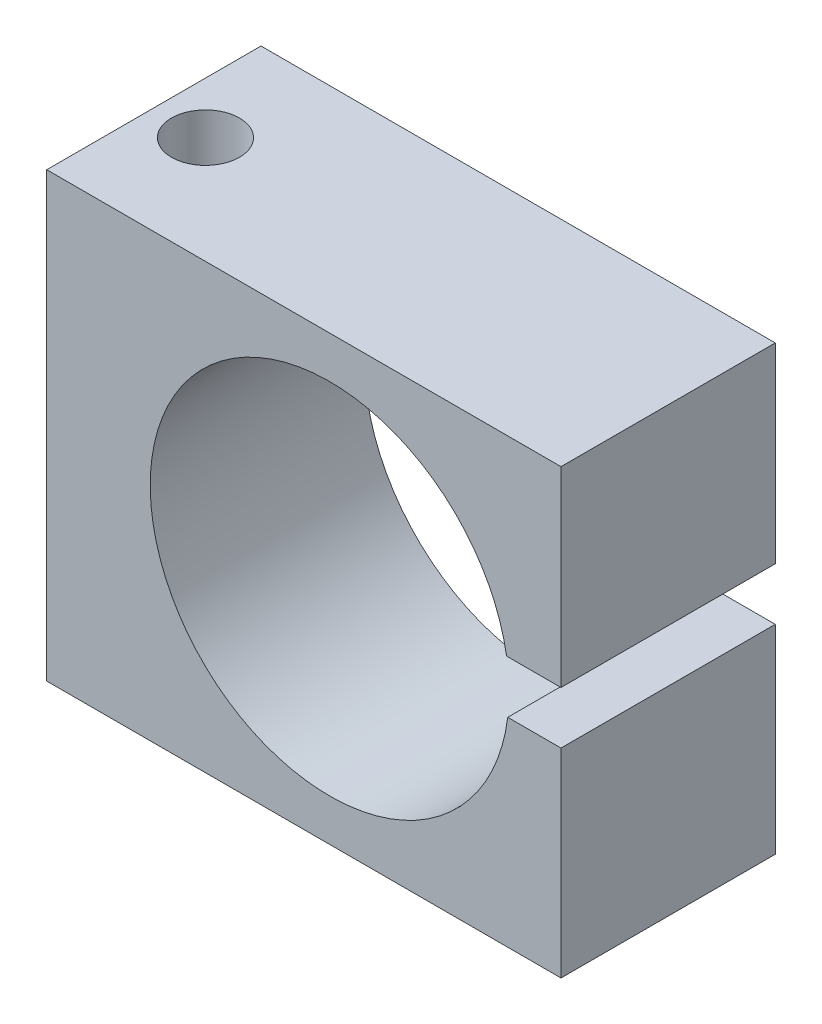
from build123d import *

# Parameters (mm, degrees)
CROQUIS1_W                    = 40
CROQUIS1_H                    = 31.334822808
SALIENTE_EXTRUIR1_DEPTH       = 20
CROQUIS2_W                    = 5.048174606
CROQUIS2_H                    = 4.893641636
CORTAR_EXTRUIR1_DEPTH         = 41.340288801
TALADRO1_D                    = 6.35
TALADRO_DE_MARGEN_PARA_M221_D = 25.4
CROQUIS7_W                    = 20
CROQUIS7_H                    = 12.852705172
CROQUIS7_H_2                  = 13.588476
SALIENTE_EXTRUIR2_DEPTH       = 8
CROQUIS8_W                    = 48
CROQUIS8_H                    = 20
SALIENTE_EXTRUIR3_DEPTH       = 5
CROQUIS9_R                    = 3.175
CORTAR_EXTRUIR2_DEPTH         = 43
CROQUIS10_W                   = 48
CROQUIS10_H                   = 20
SALIENTE_EXTRUIR4_DEPTH       = 5
CORTAR_EXTRUIR3_START         = -48
CROQUIS11_R                   = 3.175
CORTAR_EXTRUIR3_DEPTH         = 48
CROQUIS12_R                   = 16.75
CORTAR_EXTRUIR4_DEPTH         = 48


with BuildPart() as part:
    # Croquis1 → Saliente-Extruir1 (new body)
    with BuildSketch(Plane(origin=(0, 0, 0), x_dir=(-1, 0, 0), z_dir=(0, 0, -1))):
        with Locations((11.334822808, 0)):
            Rectangle(CROQUIS1_W, CROQUIS1_H)
    extrude(amount=-SALIENTE_EXTRUIR1_DEPTH)

    # Croquis2 → Cortar-Extruir1 (cut, through all)
    with BuildSketch(Plane.XY.offset(20)):
        with Locations((6.141089889, 0.367885414)):
            Rectangle(CROQUIS2_W, CROQUIS2_H)
    extrude(amount=-CORTAR_EXTRUIR1_DEPTH, mode=Mode.SUBTRACT)

    # Taladro1 (through all)
    with Locations(Plane(origin=(0, 15.667411404, 0), x_dir=(1, 0, 0), z_dir=(0, 1, 0))):
        with Locations((-26.51855843, -10)):
            Hole(TALADRO1_D / 2)

    # Taladro de margen para M221 (through all)
    with Locations(Plane(origin=(0, 0, 0), x_dir=(-1, 0, 0), z_dir=(0, 0, -1))):
        with Locations((8.767354232, 0)):
            Hole(TALADRO_DE_MARGEN_PARA_M221_D / 2)

    # Croquis7 → Saliente-Extruir2 (add)
    with BuildSketch(Plane(origin=(8.665177192, 0, 0), x_dir=(0, 0, -1), z_dir=(1, 0, 0))):
        with Locations((-10, 9.241058818)):
            Rectangle(CROQUIS7_W, CROQUIS7_H)
        with Locations((-10, -8.873173404)):
            Rectangle(CROQUIS7_W, CROQUIS7_H_2)
    extrude(amount=SALIENTE_EXTRUIR2_DEPTH)

    # Croquis8 → Saliente-Extruir3 (add)
    with BuildSketch(Plane(origin=(0, 15.667411404, 0), x_dir=(1, 0, 0), z_dir=(0, 1, 0))):
        with Locations((-7.334822808, -10)):
            Rectangle(CROQUIS8_W, CROQUIS8_H)
    extrude(amount=SALIENTE_EXTRUIR3_DEPTH)

    # Croquis9 → Cortar-Extruir2 (cut)
    with BuildSketch(Plane.XZ.offset(15.667411404)):
        with Locations(Location((-26.51855843, 10, 0), (0, 0, 90))):
            Circle(CROQUIS9_R)
    extrude(amount=-CORTAR_EXTRUIR2_DEPTH, mode=Mode.SUBTRACT)

    # Croquis10 → Saliente-Extruir4 (add)
    with BuildSketch(Plane.XZ.offset(15.667411404)):
        with Locations((-7.334822808, 10)):
            Rectangle(CROQUIS10_W, CROQUIS10_H)
    extrude(amount=SALIENTE_EXTRUIR4_DEPTH)

    # Croquis11 → Cortar-Extruir3 (cut)
    with BuildSketch(Plane(origin=(0, 20.667411404, 0), x_dir=(1, 0, 0), z_dir=(0, 1, 0)).offset(CORTAR_EXTRUIR3_START)):
        with Locations(Location((-26.51855843, -10, 0), (0, 0, 90))):
            Circle(CROQUIS11_R)
    extrude(amount=CORTAR_EXTRUIR3_DEPTH, mode=Mode.SUBTRACT)

    # Croquis12 → Cortar-Extruir4 (cut)
    with BuildSketch(Plane.XY.offset(20)):
        with Locations((-4.925615177, 0)):
            Circle(CROQUIS12_R)
    extrude(amount=-CORTAR_EXTRUIR4_DEPTH, mode=Mode.SUBTRACT)


solid = part.part
